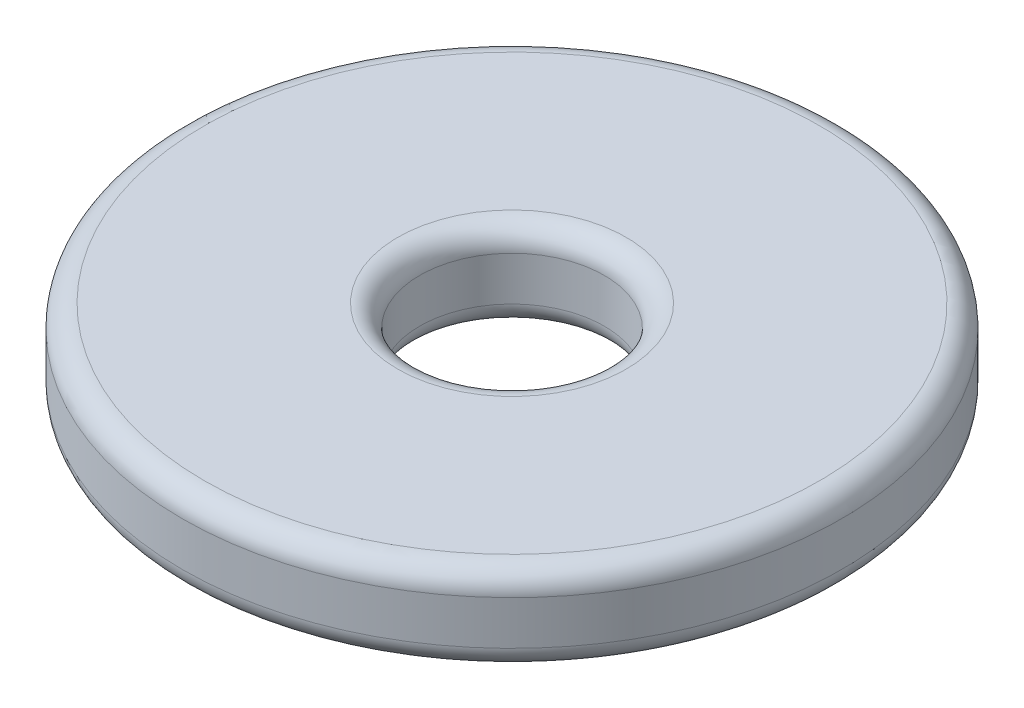
from build123d import *

# Parameters (mm, degrees)
SKETCH1_R           = 7.5
SKETCH1_R_2         = 2.1
BOSS_EXTRUDE1_DEPTH = 2
FILLET1_R           = 0.5


with BuildPart() as part:
    # Sketch1 → Boss-Extrude1 (new body)
    with BuildSketch(Plane(origin=(0, 0, 0), x_dir=(1, 0, 0), z_dir=(0, 1, 0))):
        with Locations(Location((0, 0, 0), (0, 0, 270))):
            Circle(SKETCH1_R)
        with Locations(Location((0, 0, 0), (0, 0, 270))):
            Circle(SKETCH1_R_2, mode=Mode.SUBTRACT)
    extrude(amount=BOSS_EXTRUDE1_DEPTH)

    # Fillet1
    fillet1_edges = [part.edges().sort_by_distance(p)[0] for p in [
        (0, 0, -7.5),
        (0, 2, -7.5),
        (0, 0, -2.1),
        (0, 2, -2.1),
    ]]
    fillet(fillet1_edges, radius=FILLET1_R)


solid = part.part
